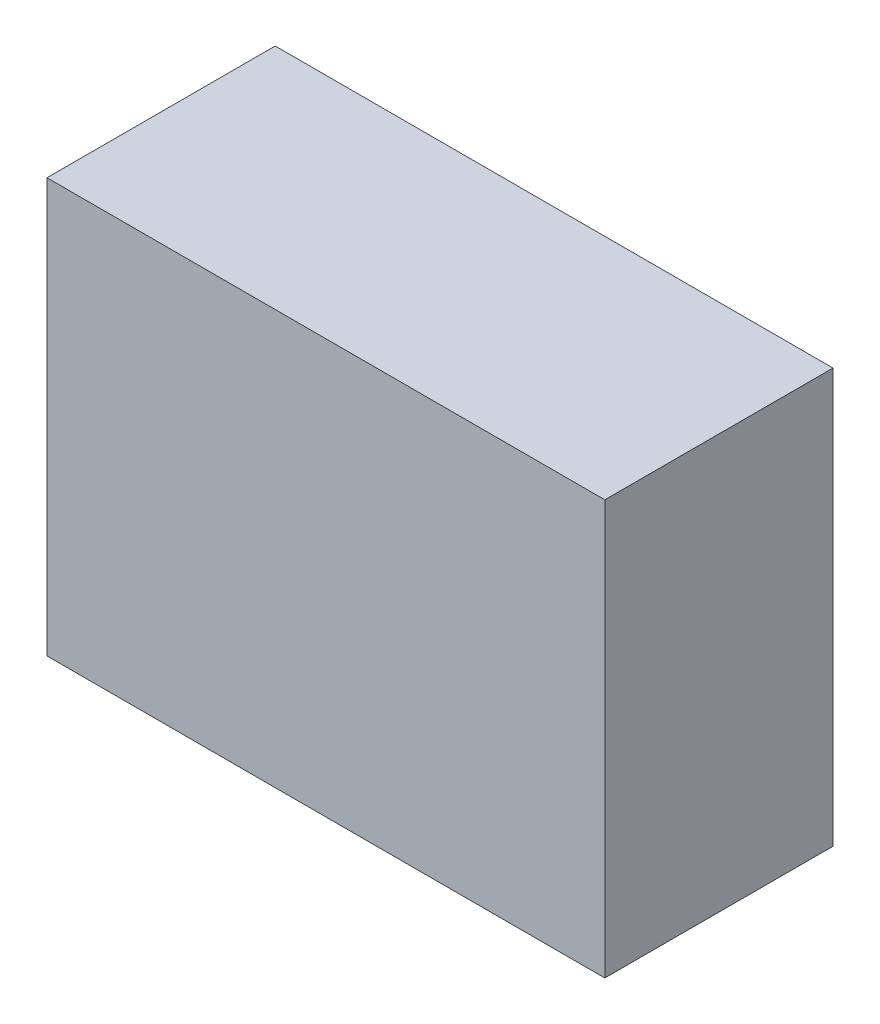
from build123d import *

# Parameters (mm, degrees)
SKETCH1_W      = 66
SKETCH1_H      = 49
ENVELOPE_DEPTH = 27


with BuildPart() as part:
    # Sketch1 → Envelope (new body)
    with BuildSketch(Plane.XY):
        Rectangle(SKETCH1_W, SKETCH1_H)
    extrude(amount=ENVELOPE_DEPTH)


solid = part.part
